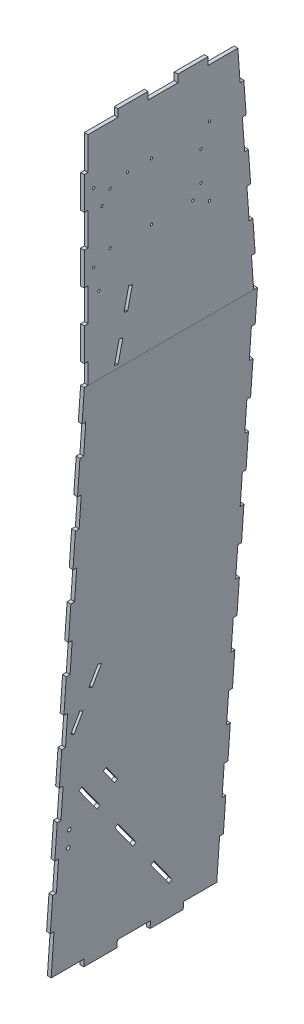
from build123d import *

# Parameters (mm, degrees)
BOSS_EXTRUDE1_DEPTH = 469.9
SKETCH2_W           = 10.16
SKETCH2_H           = 83.651125112
SKETCH2_H_2         = 83.677721465
SKETCH2_H_3         = 83.704317819
SKETCH2_H_4         = 83.730914172
SKETCH2_H_5         = 83.757510526
SKETCH2_H_6         = 83.784106879
SKETCH2_H_7         = 83.810703233
SKETCH2_H_8         = 133.264269193
CUT_EXTRUDE1_DEPTH  = 10.16
SKETCH3_W           = 10.16
SKETCH3_H           = 55.879999965
SKETCH3_H_2         = 88.9
SKETCH3_H_3         = 109.22
CUT_EXTRUDE2_DEPTH  = 12.7
SKETCH4_W           = 81.316938584
SKETCH4_H           = 20.32
SKETCH4_W_2         = 81.316938585
CUT_EXTRUDE3_DEPTH  = 12.7
SKETCH5_W           = 89.916
SKETCH5_H           = 20.32
CUT_EXTRUDE4_DEPTH  = 12.7
CUT_EXTRUDE5_DEPTH  = 137.414
SKETCH13_R          = 3.175
CUT_EXTRUDE8_DEPTH  = 2128.667464702
CUT_EXTRUDE9_DEPTH  = 2128.667464702
SKETCH20_R          = 4.7625
CUT_EXTRUDE10_DEPTH = 2107.728843747
SKETCH24_R          = 3.175
CUT_EXTRUDE12_DEPTH = 12.7


with BuildPart() as part:
    # Sketch1 → Boss-Extrude1 (new body)
    with BuildSketch(Plane.XY):
        Polygon((-215.881789204, 2052.32), (-215.881789204, 1463.040000035), (-316.088635901, 20.32), (-317.499999939, 0), (-307.333509538, 0), (-205.715298803, 1463.040000035), (-205.715298803, 2072.64), (-215.881789204, 2072.64), align=None)
    extrude(amount=-BOSS_EXTRUDE1_DEPTH)

    # Sketch2 → Cut-Extrude1 (cut)
    with BuildSketch(Plane(origin=(-315.975651309, 21.946686571, 0), x_dir=(0, 0, 1), z_dir=(-0.9975965627192115, 0.06928995634877068, 0))):
        with Locations((-464.82, 1313.852971026)):
            Rectangle(SKETCH2_W, SKETCH2_H)
        with Locations((-464.82, 1136.066269203)):
            Rectangle(SKETCH2_W, SKETCH2_H_2)
        with Locations((-464.82, 958.27956738)):
            Rectangle(SKETCH2_W, SKETCH2_H_3)
        with Locations((-464.82, 780.492865556)):
            Rectangle(SKETCH2_W, SKETCH2_H_4)
        with Locations((-464.82, 602.706163733)):
            Rectangle(SKETCH2_W, SKETCH2_H_5)
        with Locations((-464.82, 424.91946191)):
            Rectangle(SKETCH2_W, SKETCH2_H_6)
        with Locations((-464.82, 247.132760087)):
            Rectangle(SKETCH2_W, SKETCH2_H_7)
        with Locations((-464.82, 44.63257346)):
            Rectangle(SKETCH2_W, SKETCH2_H_8)
        with Locations((-5.08, 44.63257346)):
            Rectangle(SKETCH2_W, SKETCH2_H_8)
        with Locations((-5.08, 247.132760087)):
            Rectangle(SKETCH2_W, SKETCH2_H_7)
        with Locations((-5.08, 424.91946191)):
            Rectangle(SKETCH2_W, SKETCH2_H_6)
        with Locations((-5.08, 602.706163733)):
            Rectangle(SKETCH2_W, SKETCH2_H_5)
        with Locations((-5.08, 780.492865556)):
            Rectangle(SKETCH2_W, SKETCH2_H_4)
        with Locations((-5.08, 958.27956738)):
            Rectangle(SKETCH2_W, SKETCH2_H_3)
        with Locations((-5.08, 1136.066269203)):
            Rectangle(SKETCH2_W, SKETCH2_H_2)
        with Locations((-5.08, 1313.852971026)):
            Rectangle(SKETCH2_W, SKETCH2_H)
    extrude(amount=-CUT_EXTRUDE1_DEPTH, mode=Mode.SUBTRACT)

    # Sketch3 → Cut-Extrude2 (cut)
    with BuildSketch(Plane.ZY.offset(215.881789204)):
        with Locations((-5.08, 1490.980000018)):
            Rectangle(SKETCH3_W, SKETCH3_H)
        with Locations((-5.08, 1652.27)):
            Rectangle(SKETCH3_W, SKETCH3_H_2)
        Polygon((-469.9, 1463.040000035), (-459.713026258, 1463.040000035), (-453.620872406, 1546.589538567), (-463.753970086, 1547.328410273), (-457.607940173, 1631.616820512), (-447.474842492, 1630.877948806), (-441.328812579, 1715.166359045), (-451.461910259, 1715.905230751), (-445.315880346, 1800.19364099), (-435.182782665, 1799.454769284), (-429.036752752, 1883.743179522), (-439.169850432, 1884.482051228), (-433.023820518, 1968.770461467), (-422.890722838, 1968.031589761), (-415.263026258, 2072.64), (-469.9, 2072.64), align=None)
        with Locations((-5.08, 1830.07)):
            Rectangle(SKETCH3_W, SKETCH3_H_2)
        with Locations((-5.08, 2018.03)):
            Rectangle(SKETCH3_W, SKETCH3_H_3)
    extrude(amount=-CUT_EXTRUDE2_DEPTH, mode=Mode.SUBTRACT)

    # Sketch4 → Cut-Extrude3 (cut)
    with BuildSketch(Plane.ZY.offset(215.881789204)):
        with Locations((-376.086223632, 2062.48)):
            Rectangle(SKETCH4_W, SKETCH4_H)
        with Locations((-213.452346463, 2062.48)):
            Rectangle(SKETCH4_W_2, SKETCH4_H)
        with Locations((-50.818469292, 2062.48)):
            Rectangle(SKETCH4_W_2, SKETCH4_H)
    extrude(amount=-CUT_EXTRUDE3_DEPTH, mode=Mode.SUBTRACT)

    # Sketch5 → Cut-Extrude4 (cut)
    with BuildSketch(Plane(origin=(-315.975651309, 21.946686571, 0), x_dir=(0, 0, 1), z_dir=(-0.9975965627192115, 0.06928995634877068, 0))):
        with Locations((-414.782, -11.839561137)):
            Rectangle(SKETCH5_W, SKETCH5_H)
        with Locations((-234.95, -11.839561137)):
            Rectangle(SKETCH5_W, SKETCH5_H)
        with Locations((-55.118, -11.839561137)):
            Rectangle(SKETCH5_W, SKETCH5_H)
    extrude(amount=-CUT_EXTRUDE4_DEPTH, mode=Mode.SUBTRACT)

    # Sketch6 → Cut-Extrude5 (cut)
    with BuildSketch(Plane(origin=(-315.975651309, 21.946686571, 0), x_dir=(0, 0, 1), z_dir=(-0.9975965627192115, 0.06928995634877068, 0))):
        Polygon((-225.552848619, 218.022150673), (-217.372552167, 211.996509631), (-163.440168374, 285.214095065), (-171.620464825, 291.239736107), align=None)
        Polygon((-333.417616206, 71.586979805), (-325.230382227, 65.556228551), (-271.297998434, 138.773813985), (-279.485232413, 144.804565239), align=None)
        Polygon((-117.688081031, 364.457321541), (-109.500847052, 358.426570287), (-55.568463259, 431.644155721), (-63.755697238, 437.674906975), align=None)
        Polygon((-22.52887933, 586.435803877), (-44.10850301, 632.676529752), (-53.31924736, 628.378059234), (-31.73962368, 582.137333359), align=None)
        Polygon((-96.478494721, 720.859510985), (-74.89887104, 674.61878511), (-65.68812669, 678.917255627), (-87.26775037, 725.157981502), align=None)
    extrude(amount=-CUT_EXTRUDE5_DEPTH, mode=Mode.SUBTRACT)

    # Sketch13 → Cut-Extrude8 (cut, through all)
    with BuildSketch(Plane.ZY.offset(215.881789204)):
        with Locations((-25.246459893, 1731.87)):
            Circle(SKETCH13_R)
        with Locations((-70.408959893, 1755.42)):
            Circle(SKETCH13_R)
        with Locations((-182.408959893, 1755.42)):
            Circle(SKETCH13_R)
        with Locations((-25.246459893, 1918.97)):
            Circle(SKETCH13_R)
        with Locations((-47.788959893, 1865.42)):
            Circle(SKETCH13_R)
        with Locations((-182.408959893, 1910.42)):
            Circle(SKETCH13_R)
        with Locations((-117.078959893, 1910.42)):
            Circle(SKETCH13_R)
        with Locations((-70.408959893, 1895.42)):
            Circle(SKETCH13_R)
        with Locations((-317.028959893, 1865.42)):
            Circle(SKETCH13_R)
        with Locations((-294.408959893, 1755.42)):
            Circle(SKETCH13_R)
        with Locations((-317.028959893, 1785.42)):
            Circle(SKETCH13_R)
        with Locations((-339.571459893, 1731.87)):
            Circle(SKETCH13_R)
        with Locations((-339.571459893, 1918.97)):
            Circle(SKETCH13_R)
    extrude(amount=-CUT_EXTRUDE8_DEPTH, mode=Mode.SUBTRACT)

    # Sketch17 → Cut-Extrude9 (cut, through all)
    with BuildSketch(Plane.ZY.offset(215.881789204)):
        Polygon((-120.524654614, 1641.945974367), (-130.424254473, 1639.660471655), (-117.483615058, 1583.608404231), (-107.584015199, 1585.893906943), align=None)
        Polygon((-94.643375784, 1529.841839519), (-104.542975642, 1527.556336807), (-91.602336227, 1471.504269383), (-81.702736369, 1473.789772095), align=None)
    extrude(amount=-CUT_EXTRUDE9_DEPTH, mode=Mode.SUBTRACT)

    # Sketch20 → Cut-Extrude10 (cut, through all)
    with BuildSketch(Plane(origin=(-315.975651309, 21.946686571, 0), x_dir=(0, 0, 1), z_dir=(-0.9975965627192116, 0.06928995634876853, 0))):
        Polygon((-128.598334701, 451.361418049), (-162.492565561, 405.347250509), (-154.823537638, 399.698212032), (-120.929306778, 445.712379572), align=None)
        with Locations((-35.56, 347.287639338)):
            Circle(SKETCH20_R)
        with Locations((-35.56, 302.837639338)):
            Circle(SKETCH20_R)
    extrude(amount=-CUT_EXTRUDE10_DEPTH, mode=Mode.SUBTRACT)

    # Sketch24 → Cut-Extrude12 (cut)
    with BuildSketch(Plane.ZY.offset(215.881789204)):
        with Locations((-39.313746491, 1670.454214013)):
            Circle(SKETCH24_R)
    extrude(amount=-CUT_EXTRUDE12_DEPTH, mode=Mode.SUBTRACT)


solid = part.part
